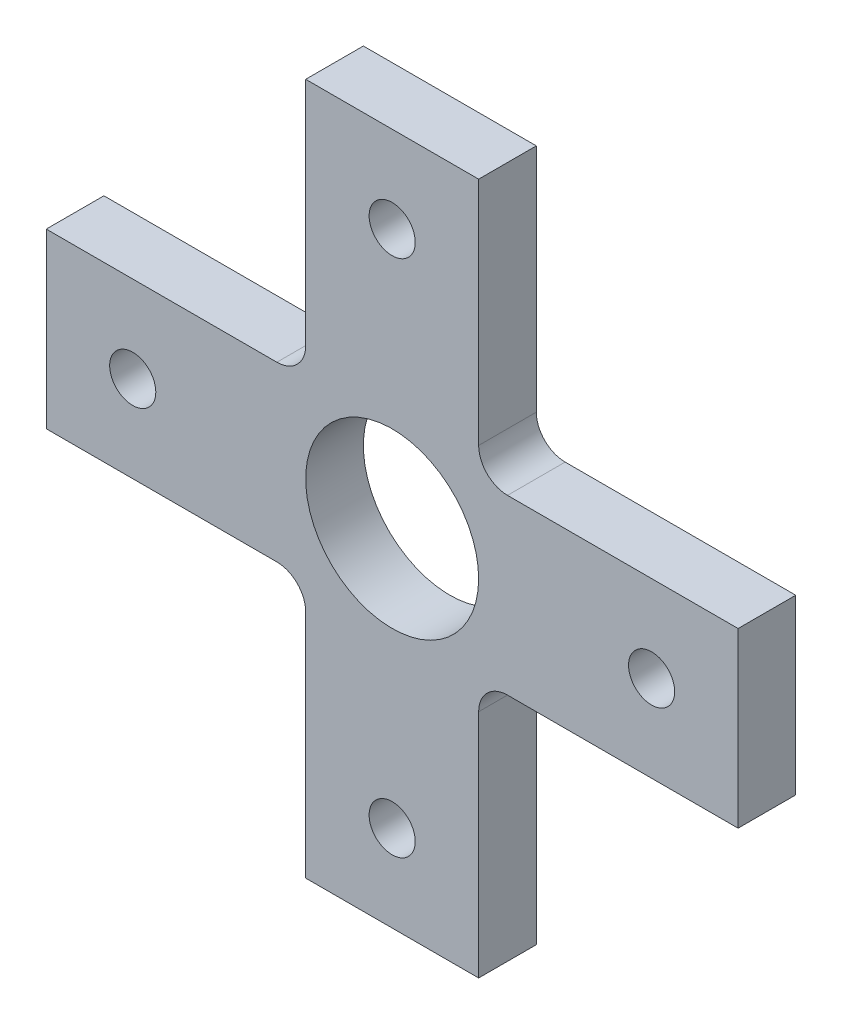
from build123d import *

# Parameters (mm, degrees)
EXTRUDE_6_DEPTH     = 10
SKETCH_7_R          = 15
CUT_EXTRUDE_1_DEPTH = 121
SKETCH_8_R          = 4
CUT_EXTRUDE_2_DEPTH = 121


with BuildPart() as part:
    # 草图6 → 凸台-拉伸6 (new body)
    with BuildSketch(Plane.XY.offset(-5)):
        with BuildLine():
            Line((-15, 60), (15, 60))
            Line((15, 60), (15, 20))
            ThreePointArc((15, 20), (16.464466094, 16.464466094), (20, 15))
            Line((20, 15), (60, 15))
            Line((60, 15), (60, -15))
            Line((60, -15), (20, -15))
            ThreePointArc((20, -15), (16.464466094, -16.464466094), (15, -20))
            Line((15, -20), (15, -60))
            Line((15, -60), (-15, -60))
            Line((-15, -60), (-15, -20))
            ThreePointArc((-15, -20), (-16.464466094, -16.464466094), (-20, -15))
            Line((-20, -15), (-60, -15))
            Line((-60, -15), (-60, 15))
            Line((-60, 15), (-20, 15))
            ThreePointArc((-20, 15), (-16.464466094, 16.464466094), (-15, 20))
            Line((-15, 20), (-15, 60))
        make_face()
    extrude(amount=EXTRUDE_6_DEPTH)

    # 草图7 → 切除-拉伸1 (cut, symmetric)
    with BuildSketch(Plane.XY.offset(-5)):
        Circle(SKETCH_7_R)
    extrude(amount=CUT_EXTRUDE_1_DEPTH, both=True, mode=Mode.SUBTRACT)

    # 草图8 → 切除-拉伸2 (cut, symmetric)
    with BuildSketch(Plane.XY.offset(-5)):
        with Locations((45, 0)):
            Circle(SKETCH_8_R)
        with Locations((-45, 0)):
            Circle(SKETCH_8_R)
        with Locations((0, 45)):
            Circle(SKETCH_8_R)
        with Locations((0, -45)):
            Circle(SKETCH_8_R)
    extrude(amount=CUT_EXTRUDE_2_DEPTH, both=True, mode=Mode.SUBTRACT)


solid = part.part
